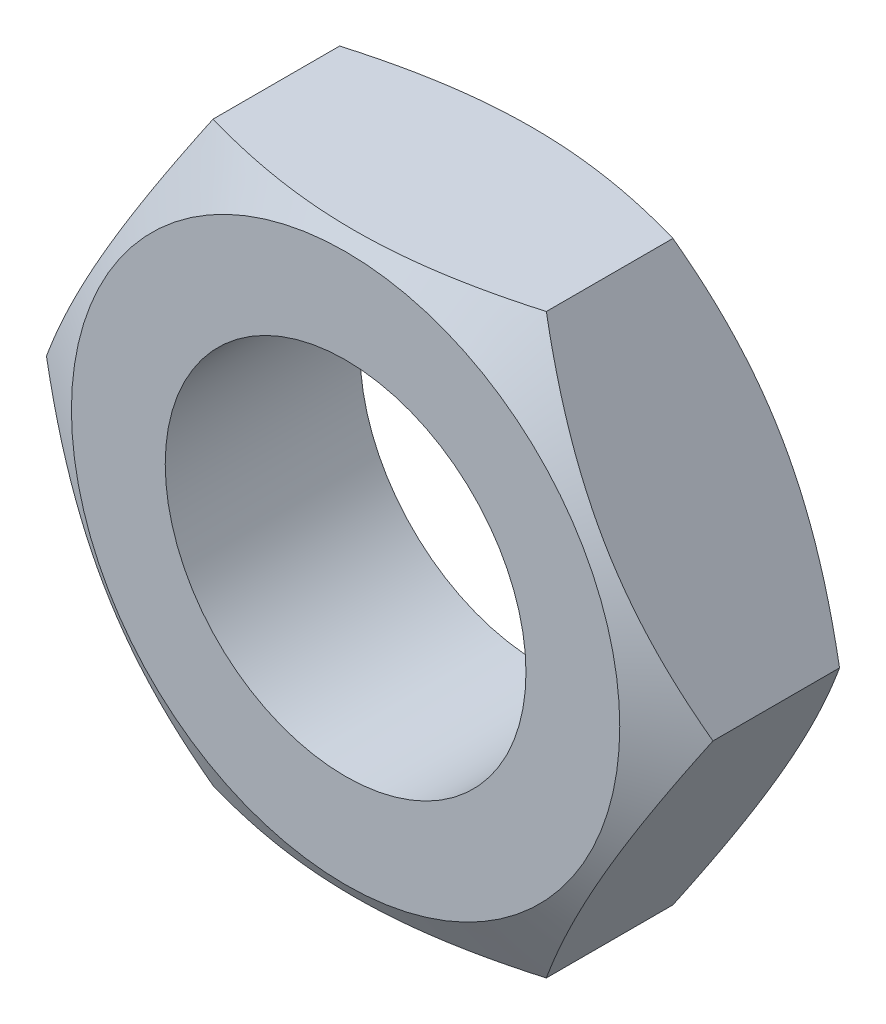
from build123d import *

# Parameters (mm, degrees)
BASENUTSKE_R            = 2.5
BASENUT_DEPTH           = 2.7
SKETCH6_OUTSIDE_W       = 40.346
SKETCH6_OUTSIDE_H       = 39.108
SKETCH6_OUTSIDE_R       = 3.8
CUT_EXTRUDE2_DEPTH      = 7.68006986
CUT_EXTRUDE2_DRAFT      = -60
MIRROR1_COPY_1_SKETCH_W = 40.346
MIRROR1_COPY_1_SKETCH_H = 39.108
MIRROR1_COPY_1_SKETCH_R = 3.8
MIRROR1_COPY_1_DEPTH    = 7.68006986
MIRROR1_COPY_1_DRAFT    = -60


with BuildPart() as part:
    # BaseNutSke → BaseNut (new body)
    with BuildSketch(Plane.XY):
        Polygon((2.309401077, -4), (-2.309401077, -4), (-4.618802154, 0), (-2.309401077, 4), (2.309401077, 4), (4.618802154, 0), align=None)
        Circle(BASENUTSKE_R, mode=Mode.SUBTRACT)
    extrude(amount=-BASENUT_DEPTH)


with BuildPart() as cut_extrude2_tool:
    # Sketch6 outside → Cut-Extrude2 (with draft: the straight prism first)
    with BuildSketch(Plane(origin=(0, 0, -2.7), x_dir=(-1, 0, 0), z_dir=(0, 0, -1))):
        Rectangle(SKETCH6_OUTSIDE_W, SKETCH6_OUTSIDE_H)
        Circle(SKETCH6_OUTSIDE_R, mode=Mode.SUBTRACT)
    extrude(amount=-CUT_EXTRUDE2_DEPTH)
    # Cut-Extrude2: the draft: its side faces are tilted about the plane it starts from
    cut_extrude2_sides = [cut_extrude2_tool.faces().sort_by_distance(p)[0] for p in [
        (0, -19.554, 1.14003493),
        (-20.173, 0, 1.14003493),
        (0, 19.554, 1.14003493),
        (20.173, 0, 1.14003493),
        (3.8, 0, 1.14003493),
    ]]
    draft(cut_extrude2_sides, Plane(origin=(0, 0, -2.7), x_dir=(-1, 0, 0), z_dir=(0, 0, -1)), CUT_EXTRUDE2_DRAFT)


with BuildPart() as part_1:
    add(part.part)

    # Cut-Extrude2: cut by cut_extrude2_tool
    add(cut_extrude2_tool.part, mode=Mode.SUBTRACT)


with BuildPart() as mirror1_copy_1_tool:
    # Mirror1 copy 1 sketch → Mirror1 copy 1 (with draft: the straight prism first)
    with BuildSketch(Plane(origin=(0, 0, 0), x_dir=(-1, 0, 0), z_dir=(0, 0, 1))):
        Rectangle(MIRROR1_COPY_1_SKETCH_W, MIRROR1_COPY_1_SKETCH_H)
        Circle(MIRROR1_COPY_1_SKETCH_R, mode=Mode.SUBTRACT)
    extrude(amount=-MIRROR1_COPY_1_DEPTH)
    # Mirror1 copy 1: the draft: its side faces are tilted about the plane it starts from
    mirror1_copy_1_sides = [mirror1_copy_1_tool.faces().sort_by_distance(p)[0] for p in [
        (0, -19.554, -3.84003493),
        (-20.173, 0, -3.84003493),
        (0, 19.554, -3.84003493),
        (20.173, 0, -3.84003493),
        (3.8, 0, -3.84003493),
    ]]
    draft(mirror1_copy_1_sides, Plane(origin=(0, 0, 0), x_dir=(-1, 0, 0), z_dir=(0, 0, 1)), MIRROR1_COPY_1_DRAFT)


with BuildPart() as part_2:
    add(part_1.part)

    # Mirror1 copy 1: cut by mirror1_copy_1_tool
    add(mirror1_copy_1_tool.part, mode=Mode.SUBTRACT)


solid = part_2.part
